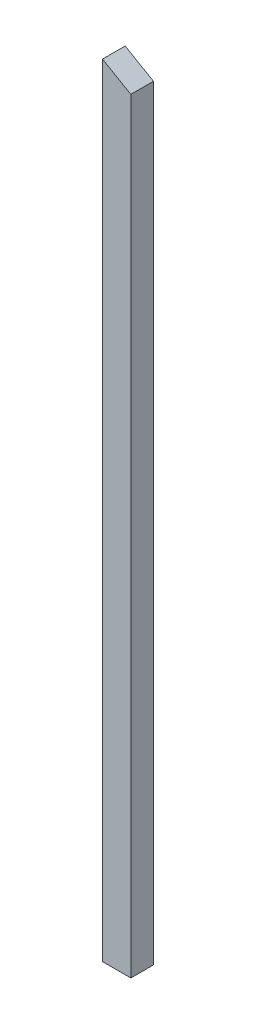
from build123d import *

# Parameters (mm, degrees)
ESQUISSE1_W        = 50
ESQUISSE1_H        = 1350
BOSS_EXTRU_1_DEPTH = 40
BOSS_EXTRU_2_DEPTH = 40


with BuildPart() as part:
    # Esquisse1 → Boss.-Extru.1 (new body)
    with BuildSketch(Plane.XY):
        with Locations((25, 675)):
            Rectangle(ESQUISSE1_W, ESQUISSE1_H)
    extrude(amount=BOSS_EXTRU_1_DEPTH)

    # Esquisse2 → Boss.-Extru.2 (add)
    with BuildSketch(Plane.XY.offset(40)):
        Polygon((50, 1350), (0, 1350), (0, 1378.867513459), align=None)
    extrude(amount=-BOSS_EXTRU_2_DEPTH)


solid = part.part
